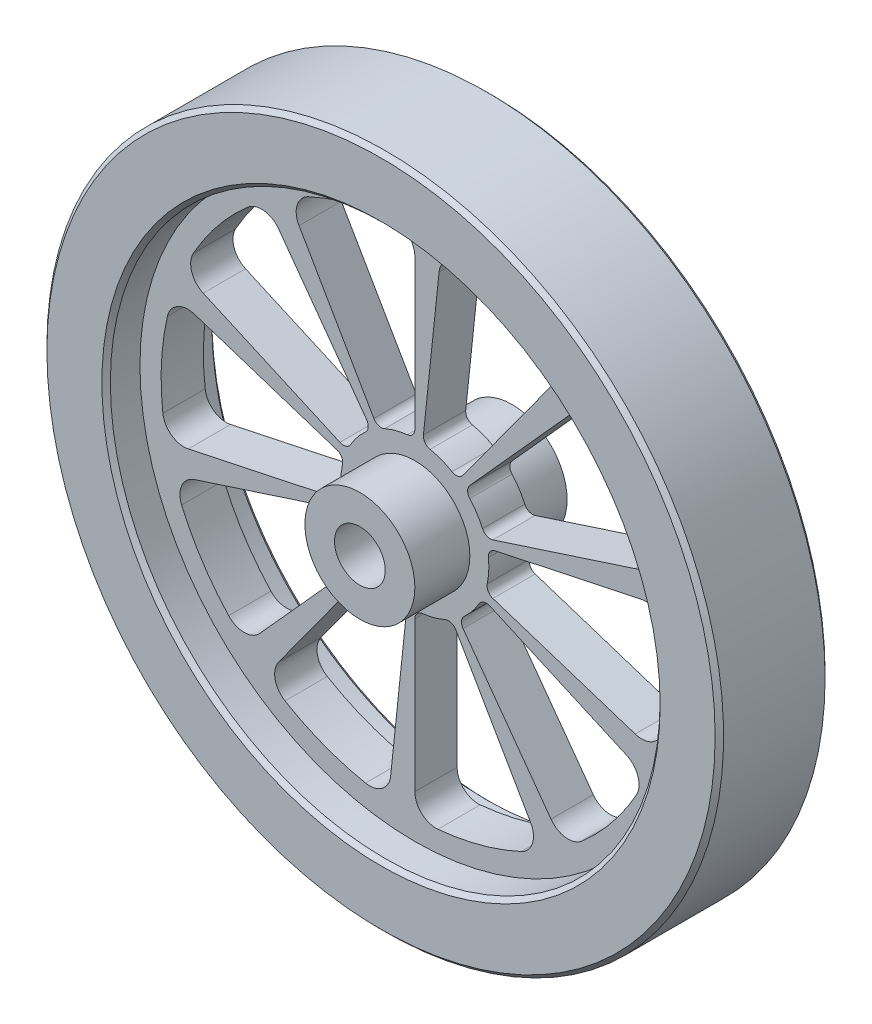
from build123d import *

# Parameters (mm, degrees)
SKETCH1_R           = 80
SKETCH1_R_2         = 6
BOSS_EXTRUDE1_DEPTH = 13
SKETCH2_R           = 65
CUT_EXTRUDE1_DEPTH  = 8
SKETCH3_R           = 13
BOSS_EXTRUDE2_DEPTH = 18
CHAMFER1_SIZE       = 1
SKETCH4_R           = 6
CUT_EXTRUDE2_DEPTH  = 119.726576637
CUT_EXTRUDE3_DEPTH  = 116.451288429
CIRPATTERN1_COUNT   = 10


with BuildPart() as part:
    # Sketch1 → Boss-Extrude1 (new, symmetric)
    with BuildSketch(Plane.XY):
        with Locations(Location((0, 0, 0), (0, 0, 180))):
            Circle(SKETCH1_R)
        with Locations(Location((0, 0, 0), (0, 0, 180))):
            Circle(SKETCH1_R_2, mode=Mode.SUBTRACT)
    extrude(amount=BOSS_EXTRUDE1_DEPTH, both=True)

    # Sketch2 → Cut-Extrude1 (cut)
    with BuildSketch(Plane.XY.offset(13)):
        Circle(SKETCH2_R)
    cut_extrude1 = extrude(amount=-CUT_EXTRUDE1_DEPTH, mode=Mode.SUBTRACT)

    # Mirror1: Cut-Extrude1 across plane
    add(cut_extrude1.mirror(Plane.XY), mode=Mode.SUBTRACT)

    # Sketch3 → Boss-Extrude2 (add, symmetric)
    with BuildSketch(Plane.XY):
        with Locations(Location((0, 0, 0), (0, 0, 180))):
            Circle(SKETCH3_R)
    extrude(amount=BOSS_EXTRUDE2_DEPTH, both=True)

    # Chamfer1
    chamfer1_edges = [part.edges().sort_by_distance(p)[0] for p in [
        (-65, 0, 13),
        (-65, 0, -13),
        (80, 0, -13),
        (80, 0, 13),
    ]]
    chamfer(chamfer1_edges, length=CHAMFER1_SIZE)

    # Sketch4 → Cut-Extrude2 (cut, through all)
    with BuildSketch(Plane.XY.offset(18)):
        Circle(SKETCH4_R)
    extrude(amount=-CUT_EXTRUDE2_DEPTH, mode=Mode.SUBTRACT)

    # Sketch5 → Cut-Extrude3 (cut, through all)
    with BuildSketch(Plane.XY.offset(5)):
        with BuildLine():
            Line((0, 54.772255751), (0, 19.397164741))
            ThreePointArc((0, 19.397164741), (-0.515032591, 18.057436487), (-1.794871795, 17.407711947))
            ThreePointArc((-1.794871795, 17.407711947), (-4.529333289, 16.90370196), (-7.149451403, 15.972956666))
            ThreePointArc((-7.149451403, 15.972956666), (-8.582686936, 15.895715021), (-9.698582371, 16.798437427))
            Line((-9.698582371, 16.798437427), (-27.386127875, 47.434164903))
            ThreePointArc((-27.386127875, 47.434164903), (-27.821744262, 51.446675992), (-25.152000934, 54.473634439))
            ThreePointArc((-25.152000934, 54.473634439), (-15.529142706, 57.955549577), (-5.454545455, 59.751551728))
            ThreePointArc((-5.454545455, 59.751551728), (-1.629000688, 58.46500048), (0, 54.772255751))
        make_face()
    cut_extrude3 = extrude(amount=-CUT_EXTRUDE3_DEPTH, mode=Mode.SUBTRACT)

    # CirPattern1: Cut-Extrude3 ×10 about axis
    cirpattern1_axis = Axis((0, 0, 0), (0, 0, 1))
    for i in range(1, CIRPATTERN1_COUNT):
        add(cut_extrude3.rotate(cirpattern1_axis, i * 360 / CIRPATTERN1_COUNT), mode=Mode.SUBTRACT)


solid = part.part
